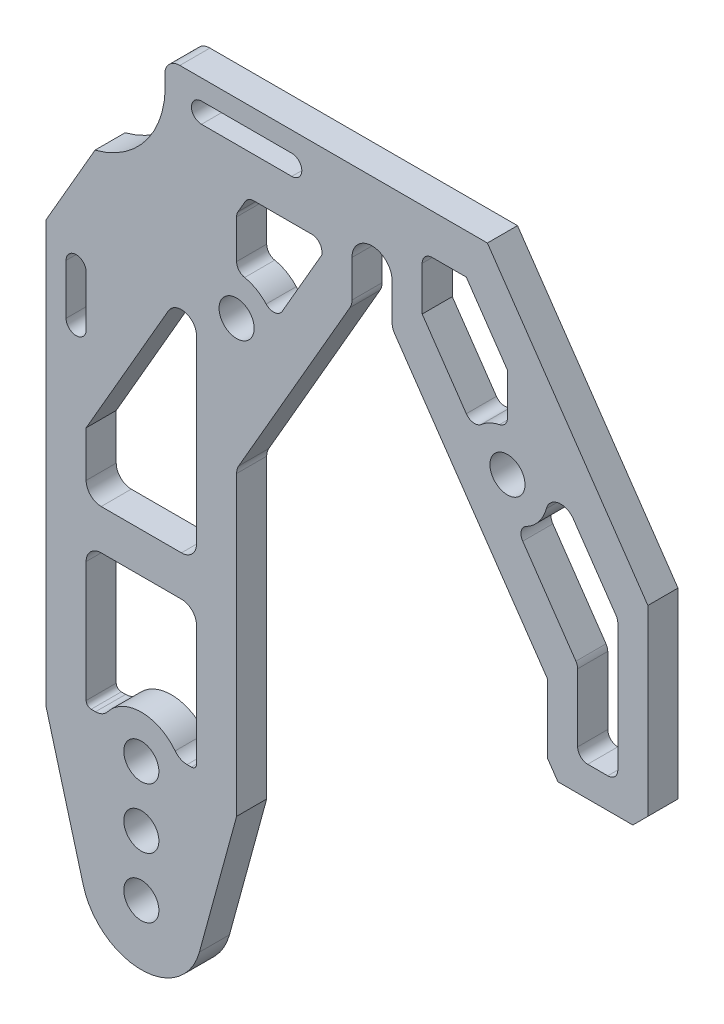
from build123d import *

# Parameters (mm, degrees)
ESBO_O1_R                = 3.5
RESSALTO_EXTRUS_O1_DEPTH = 6
FILETE1_R                = 3
CHANFRO1_SIZE            = 2
CORTE_EXTRUS_O1_DEPTH    = 6
RESSALTO_EXTRUS_O2_DEPTH = 6
CORTE_EXTRUS_O2_DEPTH    = 10
FILETE2_R                = 2
CORTE_EXTRUS_O3_DEPTH    = 10
CORTE_EXTRUS_O4_DEPTH    = 201.089979759
CORTE_EXTRUS_O5_DEPTH    = 201.089979759
FILETE3_R                = 3


with BuildPart() as part:
    # Esboço1 → Ressalto-extrusão1 (new body)
    with BuildSketch(Plane.XY):
        with BuildLine():
            Line((23.094010768, 160), (88, 160))
            Line((88, 160), (100, 142.530265141))
            Line((100, 142.530265141), (100, 114))
            Line((100, 114), (84, 114))
            Line((84, 114), (69, 135.837168574))
            Line((69, 135.837168574), (69, 144))
            ThreePointArc((69, 144), (65, 148), (61, 144))
            Line((61, 144), (61, 135.837168574))
            Line((61, 135.837168574), (38, 96))
            Line((38, 96), (38, 0))
            Line((38, 0), (0, 0))
            Line((0, 0), (0, 120))
            Line((0, 120), (23.094010768, 160))
        make_face()
        with Locations((19, 12)):
            Circle(ESBO_O1_R, mode=Mode.SUBTRACT)
        with Locations((19, 24)):
            Circle(ESBO_O1_R, mode=Mode.SUBTRACT)
        with Locations((19, 36)):
            Circle(ESBO_O1_R, mode=Mode.SUBTRACT)
        with Locations((92, 122)):
            Circle(ESBO_O1_R, mode=Mode.SUBTRACT)
        with Locations((38, 122)):
            Circle(ESBO_O1_R, mode=Mode.SUBTRACT)
        with BuildLine():
            Line((41, 156), (49, 156))
            ThreePointArc((49, 156), (51, 154), (49, 152))
            Line((49, 152), (41, 152))
            ThreePointArc((41, 152), (39, 154), (41, 156))
        make_face(mode=Mode.SUBTRACT)
        with BuildLine():
            Line((8, 115), (8, 105))
            ThreePointArc((8, 105), (6, 103), (4, 105))
            Line((4, 105), (4, 115))
            ThreePointArc((4, 115), (6, 117), (8, 115))
        make_face(mode=Mode.SUBTRACT)
    extrude(amount=RESSALTO_EXTRUS_O1_DEPTH)

    # Filete1
    filete1_edges = [part.edges().sort_by_distance(p)[0] for p in [
        (100, 114, 3),
        (84, 114, 3),
        (69, 135.837168574, 3),
        (61, 135.837168574, 3),
        (38, 96, 3),
    ]]
    fillet(filete1_edges, radius=FILETE1_R)

    # Chanfro1
    chanfro1_edges = [part.edges().sort_by_distance(p)[0] for p in [
        (38, 0, 3),
        (0, 0, 3),
    ]]
    chamfer(chanfro1_edges, length=CHANFRO1_SIZE)

    # Esboço2 → Corte-extrusão1 (cut)
    with BuildSketch(Plane.XY.offset(6)):
        with BuildLine():
            Line((75, 152), (75, 141.231728845))
            Line((75, 141.231728845), (85.255212875, 126.30207469))
            ThreePointArc((85.255212875, 126.30207469), (88.154001919, 129.014862704), (92, 130))
            Line((92, 130), (92, 140.047327347))
            Line((92, 140.047327347), (83.789682385, 152))
            Line((83.789682385, 152), (75, 152))
        make_face()
        with BuildLine():
            Line((38, 130), (38, 140.047327347))
            Line((38, 140.047327347), (40.28207662, 144))
            Line((40.28207662, 144), (55, 144))
            Line((55, 144), (55, 141.444863729))
            Line((55, 141.444863729), (45.452626018, 124.908326913))
            ThreePointArc((45.452626018, 124.908326913), (42.512947191, 128.605551275), (38, 130))
        make_face()
    extrude(amount=-CORTE_EXTRUS_O1_DEPTH, mode=Mode.SUBTRACT)

    # Esboço3 → Ressalto-extrusão2 (add, through all)
    with BuildSketch(Plane.XY.offset(6)):
        Polygon((100, 142.530265141), (120, 113.414040375), (120, 77), (117, 74), (102.060706719, 74), (100, 77), (100, 90.707020188), (83.106053471, 115.301417403), (100, 117), align=None)
    extrude(amount=-RESSALTO_EXTRUS_O2_DEPTH)

    # Esboço4 → Corte-extrusão2 (cut)
    with BuildSketch(Plane.XY.offset(6)):
        with BuildLine():
            Line((105.122276139, 120.943770271), (114, 108.019480105))
            Line((114, 108.019480105), (114, 80))
            Line((114, 80), (106, 80))
            Line((106, 80), (106, 96.101580458))
            Line((106, 96.101580458), (93.595183818, 114.160651265))
            ThreePointArc((93.595183818, 114.160651265), (97.506753293, 116.196925973), (99.745062186, 119.996500127))
            ThreePointArc((99.745062186, 119.996500127), (102.128983719, 122.199693371), (105.122276139, 120.943770271))
        make_face()
    extrude(amount=-CORTE_EXTRUS_O2_DEPTH, mode=Mode.SUBTRACT)

    # Filete2
    filete2_edges = [part.edges().sort_by_distance(p)[0] for p in [
        (75, 152, 3),
        (92, 130, 3),
        (85.255212875, 126.30207469, 3),
        (45.452626018, 124.908326913, 3),
        (38, 130, 3),
        (38, 140.047327347, 3),
        (40.28207662, 144, 3),
        (55, 144, 3),
        (114, 108.019480105, 3),
        (114, 80, 3),
        (106, 80, 3),
        (106, 96.101580458, 3),
        (93.595183818, 114.160651265, 3),
    ]]
    fillet(filete2_edges, radius=FILETE2_R)

    # Esboço5 → Corte-extrusão3 (cut)
    with BuildSketch(Plane.XY.offset(6)):
        with BuildLine():
            ThreePointArc((19.000000124, 0), (11.718734325, 2.46149015), (7.424595906, 8.836138426))
            Line((7.424595906, 8.836138426), (0, 36))
            Line((0, 36), (0, 0))
            Line((0, 0), (19.000000124, 0))
        make_face()
        with BuildLine():
            ThreePointArc((30.575404094, 8.836138426), (26.281265774, 2.461490225), (19.000000124, 0))
            Line((19.000000124, 0), (38, 0))
            Line((38, 0), (38, 36))
            Line((38, 36), (30.575404094, 8.836138426))
        make_face()
        with BuildLine():
            Line((30, 65), (30, 41))
            ThreePointArc((30, 41), (29.707106781, 40.292893219), (29, 40))
            Line((29, 40), (28.124143795, 40))
            ThreePointArc((28.124143795, 40), (26.79716619, 40.309436781), (25.743932371, 41.173913043))
            ThreePointArc((25.743932371, 41.173913043), (19, 44.5), (12.256067629, 41.173913043))
            ThreePointArc((12.256067629, 41.173913043), (11.20283381, 40.309436781), (9.875856205, 40))
            Line((9.875856205, 40), (9, 40))
            ThreePointArc((9, 40), (8.292893219, 40.292893219), (8, 41))
            Line((8, 41), (8, 65))
            ThreePointArc((8, 65), (8.878679656, 67.121320344), (11, 68))
            Line((11, 68), (27, 68))
            ThreePointArc((27, 68), (29.121320344, 67.121320344), (30, 65))
        make_face()
        with BuildLine():
            ThreePointArc((30, 79), (29.121320344, 76.878679656), (27, 76))
            Line((27, 76), (11, 76))
            ThreePointArc((11, 76), (8.878679656, 76.878679656), (8, 79))
            Line((8, 79), (8, 88.08580312))
            Line((8, 88.08580312), (24.401923789, 116.494768463))
            ThreePointArc((24.401923789, 116.494768463), (27.776457135, 117.892545942), (30, 114.994768463))
            Line((30, 114.994768463), (30, 79))
        make_face()
    extrude(amount=-CORTE_EXTRUS_O3_DEPTH, mode=Mode.SUBTRACT)

    # Esboço6 → Corte-extrusão4 (cut, through all)
    with BuildSketch(Plane.XY.offset(6)):
        with BuildLine():
            Line((31, 156), (49, 156))
            ThreePointArc((49, 156), (51, 154), (49, 152))
            Line((49, 152), (31, 152))
            ThreePointArc((31, 152), (29, 154), (31, 156))
        make_face()
    extrude(amount=-CORTE_EXTRUS_O4_DEPTH, mode=Mode.SUBTRACT)

    # Esboço7 → Corte-extrusão5 (cut, through all)
    with BuildSketch(Plane.XY.offset(6)):
        with BuildLine():
            Line((23.094010768, 160), (9.770017724, 136.92216709))
            ThreePointArc((9.770017724, 136.92216709), (21.270577597, 145.667537692), (23.094010768, 160))
        make_face()
    extrude(amount=-CORTE_EXTRUS_O5_DEPTH, mode=Mode.SUBTRACT)

    # Filete3
    filete3_edges = [part.edges().sort_by_distance(p)[0] for p in [
        (23.094010768, 160, 3),
    ]]
    fillet(filete3_edges, radius=FILETE3_R)


solid = part.part
